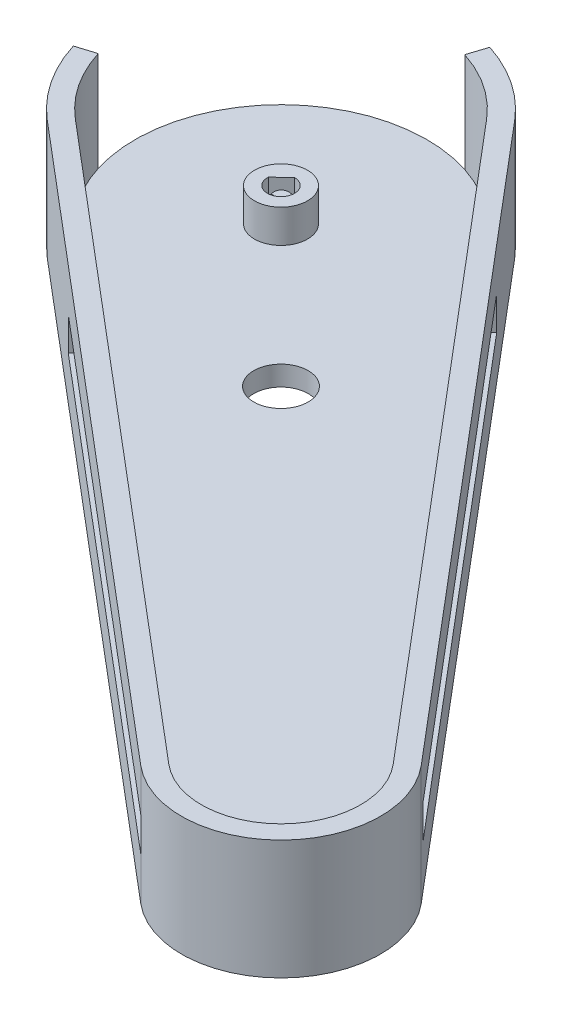
from build123d import *

# Parameters (mm, degrees)
EXTRUDE_2_DEPTH           = 3
SKETCH_4_R                = 2.25
SKETCH_4_R_2              = 2.5
CUT_EXTRUDE_2_DEPTH       = 96.402519291
SKETCH_6_R                = 3.5
CUT_EXTRUDE_3_DEPTH       = 96.402519291
SKETCH_7_R                = 3.5
CUT_EXTRUDE_4_DEPTH       = 96.402519291
CUT_EXTRUDE_5_DEPTH       = 96.402519291
EXTRUDE_4_DEPTH           = 15
EXTRUDE_5_DEPTH           = 3
SKETCH_11_R               = 4.1
CUT_EXTRUDE_6_DEPTH       = 3
SKETCH_13_R               = 3.5
EXTRUDE_6_DEPTH           = 3
SKETCH_14_R               = 2.05
EXTRUDE_7_DEPTH           = 5
EXTRUDE_START             = -5
SKETCH_15_R               = 4
SKETCH_15_R_2             = 2.05
EXTRUDE_8_DEPTH           = 5
CUT_EXTRUDE_7_DEPTH       = 96.878259721
SKETCH_18_R               = 1.397318861
CUT_EXTRUDE_8_DEPTH       = 144.753442506
CUT_EXTRUDE_9_DEPTH       = 97.527927136
CUT_EXTRUDE_9_DEPTH_BACK  = 97.527927136
CUT_EXTRUDE_11_DEPTH      = 110.140706759
CUT_EXTRUDE_11_DEPTH_BACK = 110.140706759
SKETCH_20_W               = 92.736362136
SKETCH_20_H               = 2.6
SKETCH_20_H_2             = 2.5


with BuildPart() as part:
    # 草图2 → 凸台-拉伸2 (new body)
    with BuildSketch(Plane(origin=(0, 0, 0), x_dir=(1, 0, 0), z_dir=(0, 1, 0))):
        with BuildLine():
            Line((-58.569449541, 23.337085947), (32.740581269, -53.879999426))
            ThreePointArc((32.740581269, -53.879999426), (53.033008589, -53.033008589), (53.879999426, -32.740581269))
            Line((53.879999426, -32.740581269), (-23.337085947, 58.569449541))
            ThreePointArc((-23.337085947, 58.569449541), (-60.104076401, 60.104076401), (-58.569449541, 23.337085947))
        make_face()
    extrude(amount=EXTRUDE_2_DEPTH)

    # 草图4 → 切除-拉伸2 (cut, through all)
    with BuildSketch(Plane(origin=(0, 3, 0), x_dir=(1, 0, 0), z_dir=(0, 1, 0))):
        with Locations(Location((-42.426406871, 42.426406871, 0), (0, 0, 270))):
            Circle(SKETCH_4_R)
        with Locations(Location((42.426406871, -42.426406871, 0), (0, 0, 270))):
            Circle(SKETCH_4_R_2)
    extrude(amount=-CUT_EXTRUDE_2_DEPTH, mode=Mode.SUBTRACT)

    # 草图6 → 切除-拉伸3 (cut, through all)
    with BuildSketch(Plane(origin=(0, 3, 0), x_dir=(1, 0, 0), z_dir=(0, 1, 0))):
        with Locations(Location((-42.426406871, 42.426406871, 0), (0, 0, 270))):
            Circle(SKETCH_6_R)
    extrude(amount=-CUT_EXTRUDE_3_DEPTH, mode=Mode.SUBTRACT)

    # 草图7 → 切除-拉伸4 (cut, through all)
    with BuildSketch(Plane(origin=(0, 3, 0), x_dir=(1, 0, 0), z_dir=(0, 1, 0))):
        with Locations(Location((42.426406871, -42.426406871, 0), (0, 0, 270))):
            Circle(SKETCH_7_R)
    extrude(amount=-CUT_EXTRUDE_4_DEPTH, mode=Mode.SUBTRACT)

    # 草图8 → 切除-拉伸5 (cut, through all)
    with BuildSketch(Plane(origin=(0, 3, 0), x_dir=(1, 0, 0), z_dir=(0, 1, 0))):
        Polygon((33.626672858, -22.564710472), (-15.702999665, 25.870376375), (-26.891422763, 12.98046534), (25.218843822, -32.251166492), align=None)
    extrude(amount=-CUT_EXTRUDE_5_DEPTH, mode=Mode.SUBTRACT)

    # 草图9 → 凸台-拉伸4 (add)
    with BuildSketch(Plane(origin=(0, 3, 0), x_dir=(1, 0, 0), z_dir=(0, 1, 0))):
        with BuildLine():
            ThreePointArc((-17.960284018, 47.565359346), (-19.96440182, 53.401757848), (-23.337085947, 58.569449541))
            ThreePointArc((-23.337085947, 58.569449541), (-60.104076401, 60.104076401), (-58.569449541, 23.337085947))
            ThreePointArc((-58.569449541, 23.337085947), (-53.401757848, 19.96440182), (-47.565359346, 17.960284018))
            Line((-47.565359346, 17.960284018), (-56.632284421, 25.627804458))
            ThreePointArc((-56.632284421, 25.627804458), (-57.982756057, 57.982756057), (-25.627804458, 56.632284421))
            Line((-25.627804458, 56.632284421), (-17.960284018, 47.565359346))
        make_face()
        with BuildLine():
            Line((53.879999426, -32.740581269), (-23.337085947, 58.569449541))
            ThreePointArc((-23.337085947, 58.569449541), (-19.96440182, 53.401757848), (-17.960284018, 47.565359346))
            Line((-17.960284018, 47.565359346), (45.777785554, -27.805590857))
            ThreePointArc((45.777785554, -27.805590857), (50.229311839, -29.615681908), (53.879999426, -32.740581269))
        make_face()
        with BuildLine():
            ThreePointArc((-47.565359346, 17.960284018), (-53.401757848, 19.96440182), (-58.569449541, 23.337085947))
            Line((-58.569449541, 23.337085947), (32.740581269, -53.879999426))
            ThreePointArc((32.740581269, -53.879999426), (29.615681908, -50.229311839), (27.805590857, -45.777785554))
            Line((27.805590857, -45.777785554), (-47.565359346, 17.960284018))
        make_face()
        with BuildLine():
            ThreePointArc((57.426406871, -42.426406871), (56.511929373, -37.26907657), (53.879999426, -32.740581269))
            ThreePointArc((53.879999426, -32.740581269), (50.229311839, -29.615681908), (45.777785554, -27.805590857))
            Line((45.777785554, -27.805590857), (51.589280915, -34.67774639))
            ThreePointArc((51.589280915, -34.67774639), (53.694824873, -38.30054263), (54.426406871, -42.426406871))
            ThreePointArc((54.426406871, -42.426406871), (47.47695507, -53.311808237), (34.67774639, -51.589280915))
            Line((34.67774639, -51.589280915), (27.805590857, -45.777785554))
            ThreePointArc((27.805590857, -45.777785554), (29.615681908, -50.229311839), (32.740581269, -53.879999426))
            ThreePointArc((32.740581269, -53.879999426), (48.73959212, -56.033158578), (57.426406871, -42.426406871))
        make_face()
    extrude(amount=EXTRUDE_4_DEPTH)

    # 草图10 → 凸台-拉伸5 (add)
    with BuildSketch(Plane(origin=(0, 3, 0), x_dir=(1, 0, 0), z_dir=(0, 1, 0))):
        Polygon((10.528753113, -10.528753113), (-20.427450775, 20.427450775), (-26.891422763, 12.98046534), (25.218843822, -32.251166492), (28.486536718, -28.486536718), align=None)
        Polygon((-15.702999665, 25.870376375), (-20.427450775, 20.427450775), (10.528753113, -10.528753113), (28.486536718, -28.486536718), (33.626672858, -22.564710472), align=None)
    extrude(amount=-EXTRUDE_5_DEPTH)

    # 草图11 → 切除-拉伸6 (cut)
    with BuildSketch(Plane(origin=(0, 3, 0), x_dir=(1, 0, 0), z_dir=(0, 1, 0))):
        with Locations(Location((-21.213203436, 21.213203436, 0), (0, 0, 270))):
            Circle(SKETCH_11_R)
    extrude(amount=-CUT_EXTRUDE_6_DEPTH, mode=Mode.SUBTRACT)

    # 草图13 → 凸台-拉伸6 (add)
    with BuildSketch(Plane(origin=(0, 3, 0), x_dir=(1, 0, 0), z_dir=(0, 1, 0))):
        with Locations((-42.426406871, 42.426406871)):
            Circle(SKETCH_13_R)
    extrude(amount=-EXTRUDE_6_DEPTH)

    # 草图14 → 凸台-拉伸7 (add)
    with BuildSketch(Plane(origin=(0, 3, 0), x_dir=(1, 0, 0), z_dir=(0, 1, 0))):
        with Locations(Location((-42.426406871, 42.426406871, 0), (0, 0, 270))):
            Circle(SKETCH_14_R)
    extrude(amount=EXTRUDE_7_DEPTH)

    # 草图15 → 凸台-拉伸8 (add)
    with BuildSketch(Plane(origin=(0, 8, 0), x_dir=(1, 0, 0), z_dir=(0, 1, 0)).offset(EXTRUDE_START)):
        with Locations(Location((-42.426406871, 42.426406871, 0), (0, 0, 270))):
            Circle(SKETCH_15_R)
        with Locations((-42.426406871, 42.426406871)):
            Circle(SKETCH_15_R_2, mode=Mode.SUBTRACT)
    extrude(amount=EXTRUDE_8_DEPTH)

    # 草图17 → 切除-拉伸7 (cut, through all)
    with BuildSketch(Plane(origin=(0, 8, 0), x_dir=(1, 0, 0), z_dir=(0, 1, 0))):
        with BuildLine():
            Line((-42.409215342, 44.476334785), (-43.439595085, 43.532503451))
            Line((-43.439595085, 43.532503451), (-44.469974827, 42.588672118))
            ThreePointArc((-44.469974827, 42.588672118), (-42.507603209, 40.378015513), (-40.376406871, 42.426406871))
            ThreePointArc((-40.376406871, 42.426406871), (-40.970772536, 43.869884853), (-42.409215342, 44.476334785))
        make_face()
    extrude(amount=-CUT_EXTRUDE_7_DEPTH, mode=Mode.SUBTRACT)

    # 草图18 → 切除-拉伸8 (cut, through all)
    with BuildSketch(Plane(origin=(-41.501827845, 0, -45.307504805), x_dir=(0.7373977200215518, 0, -0.6754588088899406), z_dir=(0.6754588088899406, 0, 0.7373977200215518))):
        with Locations((-2.627845445, 4.953208644)):
            Circle(SKETCH_18_R)
    extrude(amount=-CUT_EXTRUDE_8_DEPTH, mode=Mode.SUBTRACT)

    # 草图19 → 切除-拉伸9 (cut, two sides: drawn at the far end of the back side and taken through both)
    with BuildSketch(Plane(origin=(0, 3, 0), x_dir=(1, 0, 0), z_dir=(0, 1, 0)).offset(-CUT_EXTRUDE_9_DEPTH_BACK)):
        with BuildLine():
            Line((-66.29326799, 34.985107232), (-63.429244656, 35.878063189))
            ThreePointArc((-63.429244656, 35.878063189), (-57.900931168, 58.064152802), (-35.65805893, 63.35938244))
            Line((-35.65805893, 63.35938244), (-34.735102393, 66.213879108))
            ThreePointArc((-34.735102393, 66.213879108), (-60.011093572, 60.196572701), (-66.29326799, 34.985107232))
        make_face()
    extrude(amount=CUT_EXTRUDE_9_DEPTH + CUT_EXTRUDE_9_DEPTH_BACK, mode=Mode.SUBTRACT)

    # 草图20 → 切除-拉伸11 (cut, two sides: drawn at the far end of the back side and taken through both)
    with BuildSketch(Plane(origin=(-12.914434136, 0, 15.27145674), x_dir=(0.7635728369858691, 0, 0.6457217067881111), z_dir=(-0.6457217067881111, 0, 0.7635728369858691)).offset(-CUT_EXTRUDE_11_DEPTH_BACK)):
        with Locations((13.423122648, 10.3)):
            Rectangle(SKETCH_20_W, SKETCH_20_H)
        with Locations((13.423122648, 7.75)):
            Rectangle(SKETCH_20_W, SKETCH_20_H_2)
    extrude(amount=CUT_EXTRUDE_11_DEPTH + CUT_EXTRUDE_11_DEPTH_BACK, mode=Mode.SUBTRACT)


solid = part.part
